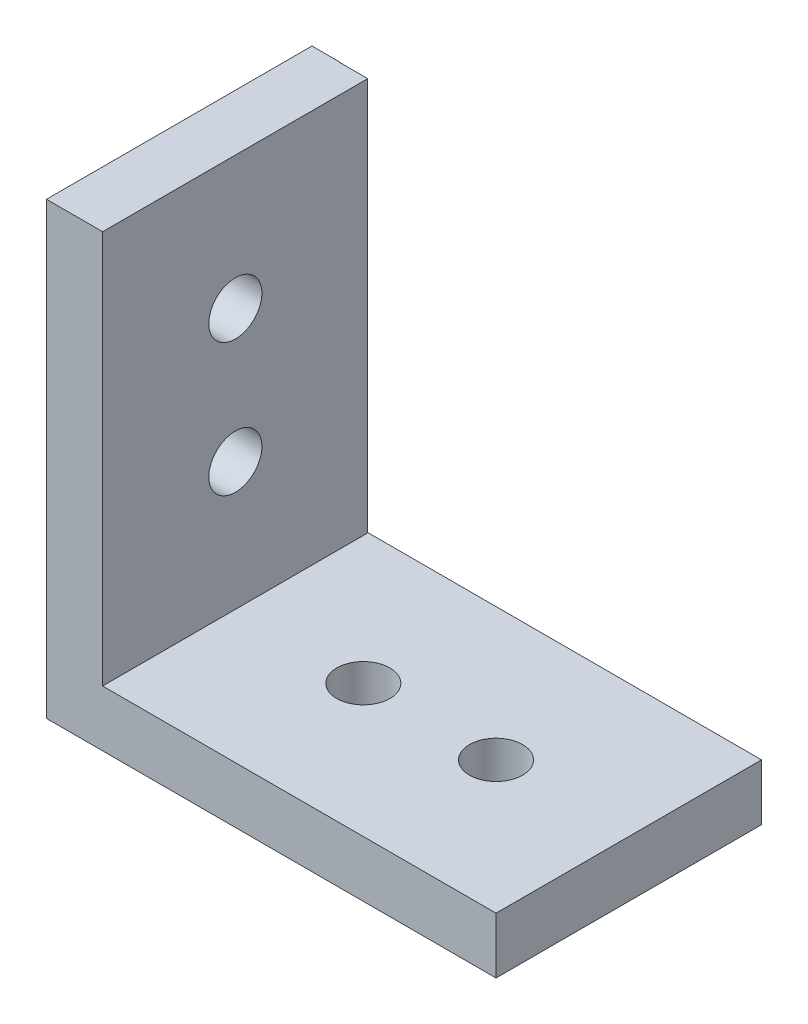
from build123d import *

# Parameters (mm, degrees)
SKETCH1_W           = 15
SKETCH1_H           = 25.4
BOSS_EXTRUDE1_DEPTH = 3.175
SKETCH2_W           = 15
SKETCH2_H           = 3.175
BOSS_EXTRUDE2_DEPTH = 22.225
SKETCH4_R           = 1.5
CUT_EXTRUDE3_DEPTH  = 37.933868265
SKETCH3_R           = 1.5
CUT_EXTRUDE4_DEPTH  = 39.927111375
SKETCH5_W           = 22.225
SKETCH5_H           = 15
CUT_EXTRUDE5_DEPTH  = 1.5875
CUT_EXTRUDE6_START  = -1.5875
SKETCH6_W           = 15
SKETCH6_H           = 23.8125
CUT_EXTRUDE6_DEPTH  = 1.5875
SKETCH7_W           = 23.8125
SKETCH7_H           = 15
SKETCH7_R           = 1.5
BOSS_EXTRUDE5_DEPTH = 1.585
BOSS_EXTRUDE6_START = 1.585
SKETCH8_W           = 14.97890093
SKETCH8_H           = 22.2275
SKETCH8_R           = 1.5
BOSS_EXTRUDE6_DEPTH = 1.585


with BuildPart() as part:
    # Sketch1 → Boss-Extrude1 (new body)
    with BuildSketch(Plane(origin=(0, 0, 0), x_dir=(0, 0, -1), z_dir=(1, 0, 0))):
        with Locations((7.5, 12.7)):
            Rectangle(SKETCH1_W, SKETCH1_H)
    extrude(amount=BOSS_EXTRUDE1_DEPTH)

    # Sketch2 → Boss-Extrude2 (add)
    with BuildSketch(Plane(origin=(3.175, 0, 0), x_dir=(0, 0, -1), z_dir=(1, 0, 0))):
        with Locations((7.5, 1.5875)):
            Rectangle(SKETCH2_W, SKETCH2_H)
    extrude(amount=BOSS_EXTRUDE2_DEPTH)

    # Sketch4 → Cut-Extrude3 (cut, through all)
    with BuildSketch(Plane(origin=(3.175, 0, 0), x_dir=(0, 0, -1), z_dir=(1, 0, 0))):
        with Locations((7.5, 17.9)):
            Circle(SKETCH4_R)
        with Locations((7.5, 10.4)):
            Circle(SKETCH4_R)
    extrude(amount=-CUT_EXTRUDE3_DEPTH, mode=Mode.SUBTRACT)

    # Sketch3 → Cut-Extrude4 (cut, through all)
    with BuildSketch(Plane.XZ):
        with Locations(Location((10.4, -7.5, 0), (0, 0, 270))):
            Circle(SKETCH3_R)
        with Locations(Location((17.9, -7.5, 0), (0, 0, 270))):
            Circle(SKETCH3_R)
    extrude(amount=-CUT_EXTRUDE4_DEPTH, mode=Mode.SUBTRACT)

    # Sketch5 → Cut-Extrude5 (cut)
    with BuildSketch(Plane(origin=(0, 3.175, 0), x_dir=(1, 0, 0), z_dir=(0, 1, 0))):
        with Locations((14.2875, 7.5)):
            Rectangle(SKETCH5_W, SKETCH5_H)
    extrude(amount=-CUT_EXTRUDE5_DEPTH, mode=Mode.SUBTRACT)

    # Sketch6 → Cut-Extrude6 (cut)
    with BuildSketch(Plane(origin=(3.175, 0, 0), x_dir=(0, 0, -1), z_dir=(1, 0, 0)).offset(CUT_EXTRUDE6_START)):
        with Locations((7.5, 13.49375)):
            Rectangle(SKETCH6_W, SKETCH6_H)
    extrude(amount=CUT_EXTRUDE6_DEPTH, mode=Mode.SUBTRACT)

    # Sketch7 → Boss-Extrude5 (add)
    with BuildSketch(Plane(origin=(0, 1.5875, 0), x_dir=(1, 0, 0), z_dir=(0, 1, 0))):
        with Locations((13.49375, 7.5)):
            Rectangle(SKETCH7_W, SKETCH7_H)
        with Locations(Location((10.4, 7.5, 0), (0, 0, 90))):
            Circle(SKETCH7_R, mode=Mode.SUBTRACT)
        with Locations(Location((17.9, 7.5, 0), (0, 0, 90))):
            Circle(SKETCH7_R, mode=Mode.SUBTRACT)
    extrude(amount=BOSS_EXTRUDE5_DEPTH)

    # Sketch8 → Boss-Extrude6 (add)
    with BuildSketch(Plane(origin=(1.5875, 0, 0), x_dir=(0, 0, -1), z_dir=(1, 0, 0)).offset(BOSS_EXTRUDE6_START)):
        with Locations((7.489450465, 14.28625)):
            Rectangle(SKETCH8_W, SKETCH8_H)
        with Locations((7.5, 17.9)):
            Circle(SKETCH8_R, mode=Mode.SUBTRACT)
        with Locations((7.5, 10.4)):
            Circle(SKETCH8_R, mode=Mode.SUBTRACT)
    extrude(amount=-BOSS_EXTRUDE6_DEPTH)


solid = part.part
